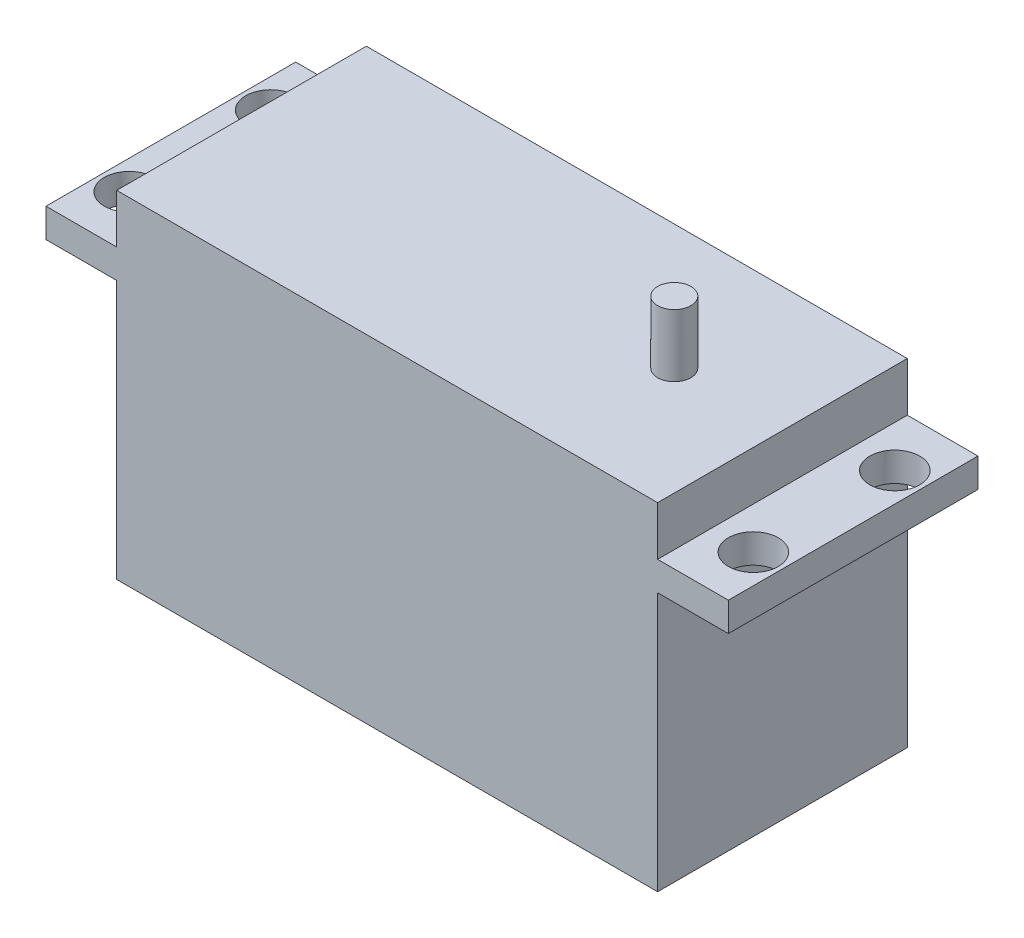
from build123d import *

# Parameters (mm, degrees)
SKETCH1_W                = 65
SKETCH1_H                = 30
BOSS_EXTRUDE1_DEPTH      = 40.5
BOSS_EXTRUDE2_DEPTH      = 8.5
BOSS_EXTRUDE2_DEPTH_BACK = 73.5
SKETCH2_W                = 30
SKETCH2_H                = 3.48
SKETCH3_R                = 3
CUT_EXTRUDE1_DEPTH       = 87.599133945
SKETCH4_R                = 2
BOSS_EXTRUDE3_DEPTH      = 7.5


with BuildPart() as part:
    # Sketch1 → Boss-Extrude1 (new body)
    with BuildSketch(Plane(origin=(0, 0, 0), x_dir=(1, 0, 0), z_dir=(0, 1, 0))):
        with Locations((32.5, 15)):
            Rectangle(SKETCH1_W, SKETCH1_H)
    extrude(amount=BOSS_EXTRUDE1_DEPTH)

    # Sketch2 → Boss-Extrude2 (add, two sides: drawn at the far end of the back side and taken through both)
    with BuildSketch(Plane(origin=(65, 0, 0), x_dir=(0, 0, -1), z_dir=(1, 0, 0)).offset(-BOSS_EXTRUDE2_DEPTH_BACK)):
        with Locations((15, 32.86)):
            Rectangle(SKETCH2_W, SKETCH2_H)
    extrude(amount=BOSS_EXTRUDE2_DEPTH + BOSS_EXTRUDE2_DEPTH_BACK)

    # Sketch3 → Cut-Extrude1 (cut, through all)
    with BuildSketch(Plane(origin=(0, 34.6, 0), x_dir=(1, 0, 0), z_dir=(0, 1, 0))):
        with Locations(Location((70, 23.5, 0), (0, 0, 270))):
            Circle(SKETCH3_R)
        with Locations(Location((70, 6.5, 0), (0, 0, 270))):
            Circle(SKETCH3_R)
        with Locations(Location((-5, 23.5, 0), (0, 0, 270))):
            Circle(SKETCH3_R)
        with Locations(Location((-5, 6.5, 0), (0, 0, 270))):
            Circle(SKETCH3_R)
    extrude(amount=-CUT_EXTRUDE1_DEPTH, mode=Mode.SUBTRACT)

    # Sketch4 → Boss-Extrude3 (add)
    with BuildSketch(Plane(origin=(0, 40.5, 0), x_dir=(1, 0, 0), z_dir=(0, 1, 0))):
        with Locations(Location((52, 15, 0), (0, 0, 90))):
            Circle(SKETCH4_R)
    extrude(amount=BOSS_EXTRUDE3_DEPTH)


solid = part.part
